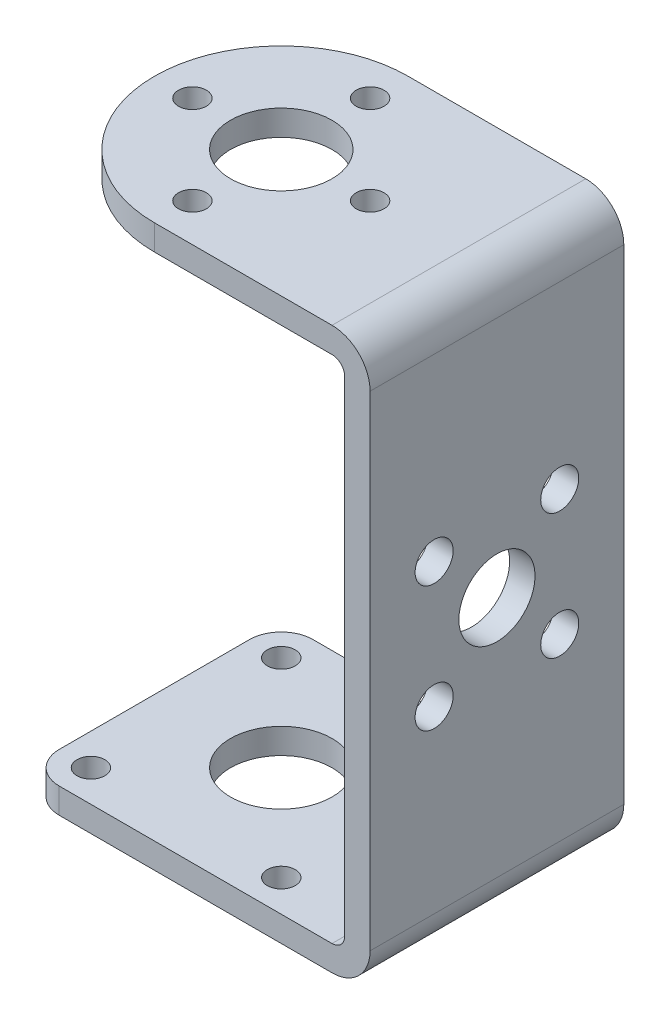
from build123d import *

# Parameters (mm, degrees)
BOSS_EXTRUDE1_DEPTH                 = 44.2
SKETCH2_W                           = 15
SKETCH2_H                           = 42.2
CUT_EXTRUDE1_DEPTH                  = 35.313408458
SKETCH3_W                           = 20
SKETCH3_H                           = 2
BOSS_EXTRUDE2_DEPTH                 = 25
F_3_0_3_DIAMETER_HOLE1_D            = 3
F_3_0_3_DIAMETER_HOLE1_DEPTH        = 2
F_6_0_6_DIAMETER_HOLE1_D            = 6
F_6_0_6_DIAMETER_HOLE1_DEPTH        = 2
F_8_0_8_DIAMETER_HOLE1_D            = 8
F_8_0_8_DIAMETER_HOLE1_DEPTH        = 2
SKETCH12_W                          = 1.1
SKETCH12_H                          = 2
F_2_2_2_2_DIAMETER_HOLE2_AT_2_COUNT = 2
F_2_2_2_2_DIAMETER_HOLE2_AT_2_PITCH = 9.899494937
F_2_2_2_2_DIAMETER_HOLE2_AT_3_COUNT = 2
F_2_2_2_2_DIAMETER_HOLE2_AT_3_PITCH = 14
F_2_2_2_2_DIAMETER_HOLE2_AT_4_COUNT = 2
F_2_2_2_2_DIAMETER_HOLE2_AT_4_PITCH = 9.899494937
SKETCH14_W                          = 4
SKETCH14_H                          = 2
FILLET1_R                           = 1
FILLET2_R                           = 2.5
FILLET3_R                           = 3
SKETCH16_W                          = 10
SKETCH16_H                          = 40.2
CUT_EXTRUDE2_DEPTH                  = 23
SKETCH17_R                          = 1.1
CUT_EXTRUDE3_DEPTH                  = 23


with BuildPart() as part:
    # Sketch1 → Boss-Extrude1 (new body)
    with BuildSketch(Plane.XZ.offset(22.1)):
        with BuildLine():
            Line((17, 10), (0, 10))
            ThreePointArc((0, 10), (-10, 0), (0, -10))
            Line((0, -10), (17, -10))
            Line((17, -10), (17, 10))
        make_face()
    extrude(amount=-BOSS_EXTRUDE1_DEPTH)

    # Sketch2 → Cut-Extrude1 (cut, through all)
    with BuildSketch(Plane(origin=(0, 0, -10), x_dir=(-1, 0, 0), z_dir=(0, 0, -1))):
        with Locations((-7.5, -1)):
            Rectangle(SKETCH2_W, SKETCH2_H)
    extrude(amount=-CUT_EXTRUDE1_DEPTH, mode=Mode.SUBTRACT)

    # Sketch3 → Boss-Extrude2 (add)
    with BuildSketch(Plane.ZY.offset(-15)):
        with Locations((0, -21.1)):
            Rectangle(SKETCH3_W, SKETCH3_H)
    extrude(amount=BOSS_EXTRUDE2_DEPTH)

    # Ø3.0 (3) Diameter Hole1
    with Locations(Plane.ZY.offset(-15)):
        with Locations((4.949747468, 4.949747468), (4.949747468, -4.949747468), (-4.949747468, -4.949747468), (-4.949747468, 4.949747468)):
            Hole(F_3_0_3_DIAMETER_HOLE1_D / 2, depth=F_3_0_3_DIAMETER_HOLE1_DEPTH)

    # Ø6.0 (6) Diameter Hole1
    with Locations(Plane.ZY.offset(-15)):
        with Locations((0, 0)):
            Hole(F_6_0_6_DIAMETER_HOLE1_D / 2, depth=F_6_0_6_DIAMETER_HOLE1_DEPTH)

    # Ø8.0 (8) Diameter Hole1
    with Locations(Plane(origin=(0, -22.1, 0), x_dir=(-1, 0, 0), z_dir=(0, -1, 0))):
        with Locations((0, 0)):
            Hole(F_8_0_8_DIAMETER_HOLE1_D / 2, depth=F_8_0_8_DIAMETER_HOLE1_DEPTH)

    # Sketch12 → Ø2.2 (2.2) Diameter Hole2 (revolve, cut)
    with BuildSketch(Plane(origin=(0, 20.1, -7), x_dir=(0, 0, -1), z_dir=(1, 0, 0))):
        with Locations((0.55, 1)):
            Rectangle(SKETCH12_W, SKETCH12_H)
    f_2_2_2_2_diameter_hole2 = revolve(axis=Axis((0, 13.75, -7), (0, 1, 0)), mode=Mode.SUBTRACT)

    # Ø2.2 (2.2) Diameter Hole2 at 2: Ø2.2 (2.2) Diameter Hole2 ×2
    with Locations(*[Vector(-0.7071067811865476, 0, 0.7071067811865476) * (i * F_2_2_2_2_DIAMETER_HOLE2_AT_2_PITCH) for i in range(1, F_2_2_2_2_DIAMETER_HOLE2_AT_2_COUNT)]):
        add(f_2_2_2_2_diameter_hole2, mode=Mode.SUBTRACT)

    # Ø2.2 (2.2) Diameter Hole2 at 3: Ø2.2 (2.2) Diameter Hole2 ×2
    with Locations(*[(0, 0, i * F_2_2_2_2_DIAMETER_HOLE2_AT_3_PITCH) for i in range(1, F_2_2_2_2_DIAMETER_HOLE2_AT_3_COUNT)]):
        add(f_2_2_2_2_diameter_hole2, mode=Mode.SUBTRACT)

    # Ø2.2 (2.2) Diameter Hole2 at 4: Ø2.2 (2.2) Diameter Hole2 ×2
    with Locations(*[Vector(0.7071067811865476, 0, 0.7071067811865476) * (i * F_2_2_2_2_DIAMETER_HOLE2_AT_4_PITCH) for i in range(1, F_2_2_2_2_DIAMETER_HOLE2_AT_4_COUNT)]):
        add(f_2_2_2_2_diameter_hole2, mode=Mode.SUBTRACT)

    # Sketch14 → Ø8.0 (8) Diameter Hole2 (revolve, cut)
    with BuildSketch(Plane(origin=(0, 20.1, 0), x_dir=(0, 0, -1), z_dir=(1, 0, 0))):
        with Locations((2, 1)):
            Rectangle(SKETCH14_W, SKETCH14_H)
    revolve(axis=Axis((0, 13.75, 0), (0, 1, 0)), mode=Mode.SUBTRACT)

    # Fillet1
    fillet1_edges = [part.edges().sort_by_distance(p)[0] for p in [
        (15, 20.1, 0),
        (15, -20.1, 0),
    ]]
    fillet(fillet1_edges, radius=FILLET1_R)

    # Fillet2
    fillet2_edges = [part.edges().sort_by_distance(p)[0] for p in [
        (-10, -21.1, -10),
        (-10, -21.1, 10),
    ]]
    fillet(fillet2_edges, radius=FILLET2_R)

    # Fillet3
    fillet3_edges = [part.edges().sort_by_distance(p)[0] for p in [
        (17, 22.1, 0),
        (17, -22.1, 0),
    ]]
    fillet(fillet3_edges, radius=FILLET3_R)

    # Sketch16 → Cut-Extrude2 (cut)
    with BuildSketch(Plane.XY.offset(10)):
        with Locations((-5, 0)):
            Rectangle(SKETCH16_W, SKETCH16_H)
    extrude(amount=-CUT_EXTRUDE2_DEPTH, mode=Mode.SUBTRACT)

    # Sketch17 → Cut-Extrude3 (cut)
    with BuildSketch(Plane.XZ.offset(22.1)):
        with Locations(Location((-7.5, -7.5, 0), (0, 0, 270))):
            Circle(SKETCH17_R)
        with Locations((-7.5, 7.5)):
            Circle(SKETCH17_R)
        with Locations(Location((7.5, 7.5, 0), (0, 0, 270))):
            Circle(SKETCH17_R)
        with Locations((7.5, -7.5)):
            Circle(SKETCH17_R)
    extrude(amount=-CUT_EXTRUDE3_DEPTH, mode=Mode.SUBTRACT)


solid = part.part
